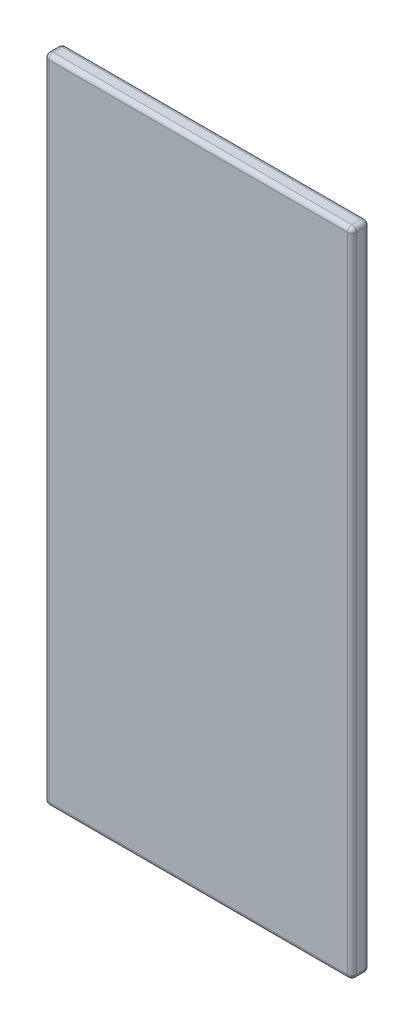
from build123d import *

# Parameters (mm, degrees)
SKETCH1_W           = 34.7
SKETCH1_H           = 73.5
BOSS_EXTRUDE1_DEPTH = 2
FILLET1_R           = 0.5


with BuildPart() as part:
    # Sketch1 → Boss-Extrude1 (new body)
    with BuildSketch(Plane.XY):
        Rectangle(SKETCH1_W, SKETCH1_H)
    extrude(amount=BOSS_EXTRUDE1_DEPTH)

    # Fillet1
    fillet1_edges = [part.edges().sort_by_distance(p)[0] for p in [
        (-17.35, 0, 2),
        (0, -36.75, 2),
        (17.35, 0, 2),
        (0, -36.75, 0),
        (-17.35, 0, 0),
        (0, 36.75, 0),
        (17.35, 0, 0),
        (17.35, -36.75, 1),
        (-17.35, -36.75, 1),
        (-17.35, 36.75, 1),
        (17.35, 36.75, 1),
        (0, 36.75, 2),
    ]]
    fillet(fillet1_edges, radius=FILLET1_R)


solid = part.part
